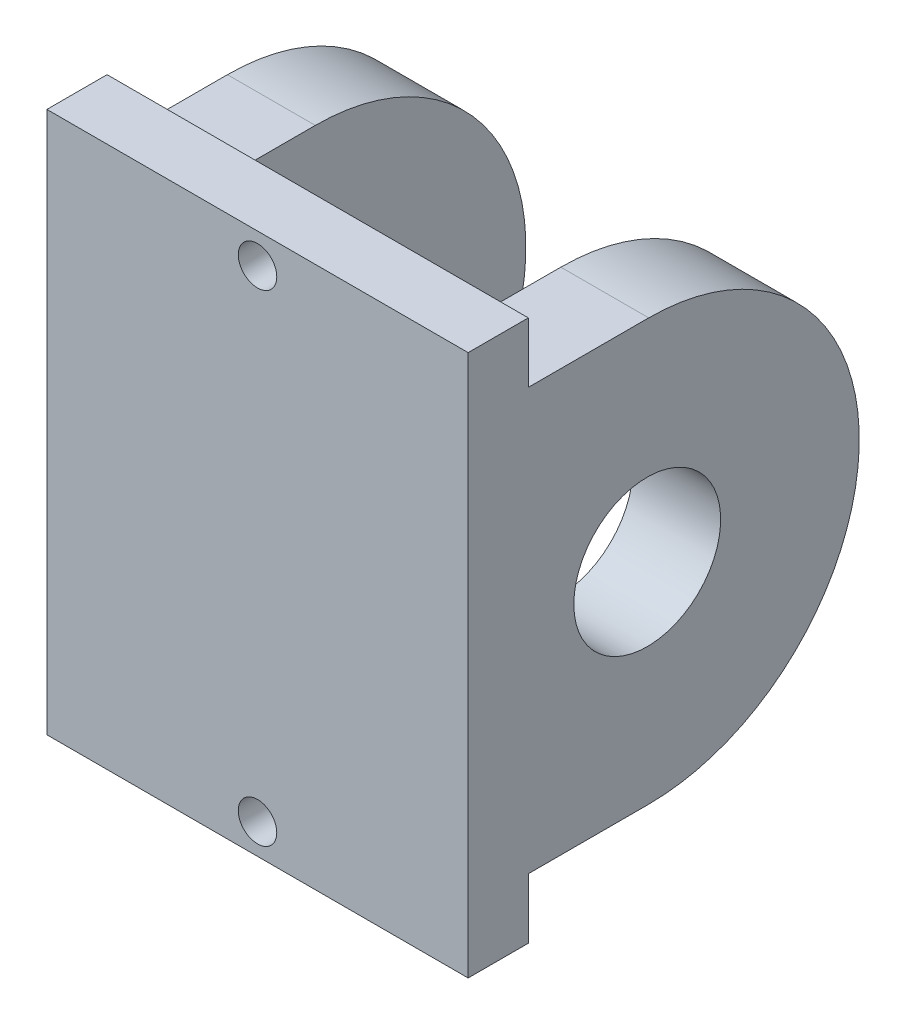
from build123d import *

# Parameters (mm, degrees)
SKETCH_1_W          = 35
SKETCH_1_H          = 35
EXTRUDE_1_DEPTH     = 5
EXTRUDE_2_DEPTH     = 7.3
EXTRUDE_START       = -7.3
EXTRUDE_3_DEPTH     = 7.3
SKETCH_4_W          = 35
SKETCH_4_H          = 45
EXTRUDE_4_DEPTH     = 5
SKETCH_6_R          = 6.1
CUT_EXTRUDE_1_DEPTH = 46.051329388
SKETCH_7_R          = 6.1
CUT_EXTRUDE_2_DEPTH = 46.051329388
SKETCH_8_R          = 1.6
CUT_EXTRUDE_3_DEPTH = 10


with BuildPart() as part:
    # 草图1 → 凸台-拉伸1 (new body)
    with BuildSketch(Plane.XY):
        Rectangle(SKETCH_1_W, SKETCH_1_H)
    extrude(amount=EXTRUDE_1_DEPTH)

    # 草图2 → 凸台-拉伸2 (add)
    with BuildSketch(Plane.ZY.offset(17.5)):
        with BuildLine():
            Line((5, 17.5), (-10, 17.5))
            Line((-10, 17.5), (-10, 17.496950369))
            ThreePointArc((-10, 17.496950369), (-27.496950369, 0), (-10, -17.496950369))
            Line((-10, -17.496950369), (-10, -17.5))
            Line((-10, -17.5), (5, -17.5))
            Line((5, -17.5), (5, 17.5))
        make_face()
    extrude(amount=-EXTRUDE_2_DEPTH)

    # 草图3 → 凸台-拉伸3 (add)
    with BuildSketch(Plane(origin=(17.5, 0, 0), x_dir=(0, 0, -1), z_dir=(1, 0, 0)).offset(EXTRUDE_START)):
        with BuildLine():
            Line((10, 17.5), (-5, 17.5))
            Line((-5, 17.5), (-5, -17.5))
            Line((-5, -17.5), (10, -17.5))
            Line((10, -17.5), (10, -17.496950369))
            ThreePointArc((10, -17.496950369), (27.496950369, 0), (10, 17.496950369))
            Line((10, 17.496950369), (10, 17.5))
        make_face()
    extrude(amount=EXTRUDE_3_DEPTH)

    # 草图4 → 凸台-拉伸4 (add)
    with BuildSketch(Plane.XY.offset(5)):
        Rectangle(SKETCH_4_W, SKETCH_4_H)
    extrude(amount=-EXTRUDE_4_DEPTH)

    # 草图6 → 切除-拉伸1 (cut, through all)
    with BuildSketch(Plane(origin=(-10.2, 0, 0), x_dir=(0, 0, -1), z_dir=(1, 0, 0))):
        with Locations((9.880544607, 0)):
            Circle(SKETCH_6_R)
    extrude(amount=-CUT_EXTRUDE_1_DEPTH, mode=Mode.SUBTRACT)

    # 草图7 → 切除-拉伸2 (cut, through all)
    with BuildSketch(Plane.ZY.offset(-10.2)):
        with Locations(Location((-9.880544607, 0, 0), (0, 0, 180))):
            Circle(SKETCH_7_R)
    extrude(amount=-CUT_EXTRUDE_2_DEPTH, mode=Mode.SUBTRACT)

    # 草图8 → 切除-拉伸3 (cut)
    with BuildSketch(Plane(origin=(0, 0, 0), x_dir=(-1, 0, 0), z_dir=(0, 0, -1))):
        with Locations((0, 20)):
            Circle(SKETCH_8_R)
        with Locations((0, -20)):
            Circle(SKETCH_8_R)
    extrude(amount=-CUT_EXTRUDE_3_DEPTH, mode=Mode.SUBTRACT)


solid = part.part
